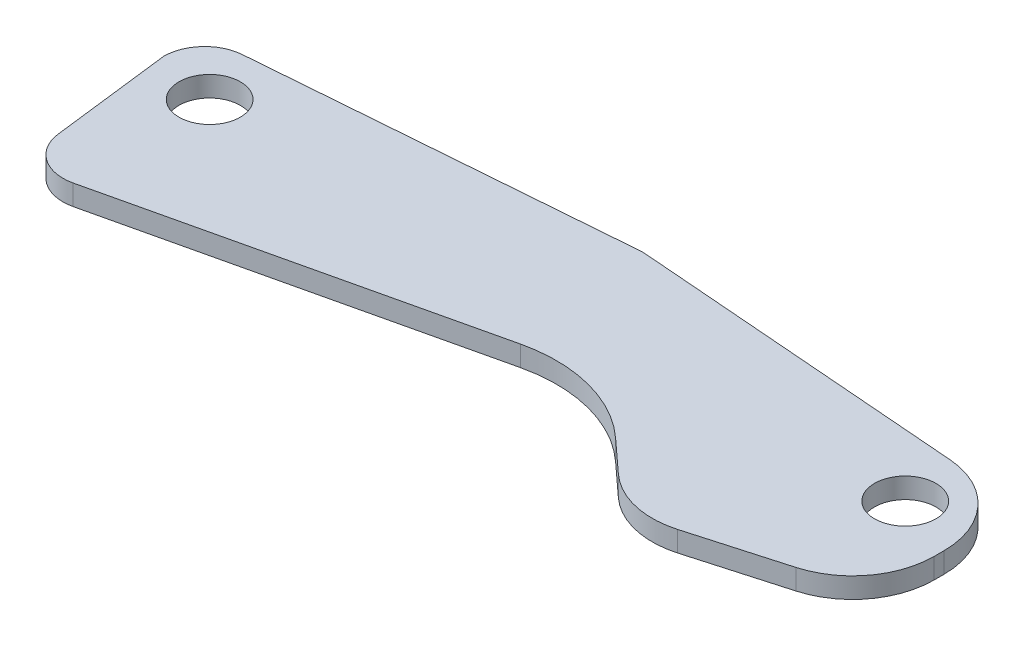
from build123d import *

# Parameters (mm, degrees)
SKETCH1_W           = 40
SKETCH1_H           = 11.5
BOSS_EXTRUDE1_DEPTH = 1
CUT_EXTRUDE1_DEPTH  = 1
FILLET1_R           = 2
FILLET2_R           = 4
FILLET3_R           = 2
CUT_EXTRUDE2_DEPTH  = 1
CUT_EXTRUDE3_DEPTH  = 1
FILLET4_R           = 2
FILLET5_R           = 7
FILLET6_R           = 4
FILLET7_R           = 4
SKETCH5_R           = 1.5
SKETCH5_R_2         = 1.501453264
CUT_EXTRUDE4_DEPTH  = 1


with BuildPart() as part:
    # Sketch1 → Boss-Extrude1 (new body)
    with BuildSketch(Plane(origin=(0, 0, 0), x_dir=(1, 0, 0), z_dir=(0, 1, 0))):
        Rectangle(SKETCH1_W, SKETCH1_H)
    extrude(amount=BOSS_EXTRUDE1_DEPTH)

    # Sketch2 → Cut-Extrude1 (cut)
    with BuildSketch(Plane(origin=(0, 1, 0), x_dir=(1, 0, 0), z_dir=(0, 1, 0))):
        Polygon((-20, 4.177870703), (0, 5.75), (-20, 5.75), align=None)
        Polygon((20, 5.75), (0, 5.75), (20, 4.177870703), align=None)
    extrude(amount=-CUT_EXTRUDE1_DEPTH, mode=Mode.SUBTRACT)

    # Fillet1
    fillet1_edges = [part.edges().sort_by_distance(p)[0] for p in [
        (0, 0.5, -5.75),
    ]]
    fillet(fillet1_edges, radius=FILLET1_R)

    # Fillet2
    fillet2_edges = [part.edges().sort_by_distance(p)[0] for p in [
        (20, 0.5, -4.177870703),
    ]]
    fillet(fillet2_edges, radius=FILLET2_R)

    # Fillet3
    fillet3_edges = [part.edges().sort_by_distance(p)[0] for p in [
        (-20, 0.5, -4.177870703),
    ]]
    fillet(fillet3_edges, radius=FILLET3_R)

    # Sketch3 → Cut-Extrude2 (cut)
    with BuildSketch(Plane(origin=(0, 1, 0), x_dir=(1, 0, 0), z_dir=(0, 1, 0))):
        Polygon((-20, 2.328914172), (-19.016050198, -5.75), (-20, -5.75), align=None)
    extrude(amount=-CUT_EXTRUDE2_DEPTH, mode=Mode.SUBTRACT)

    # Sketch4 → Cut-Extrude3 (cut)
    with BuildSketch(Plane(origin=(0, 1, 0), x_dir=(1, 0, 0), z_dir=(0, 1, 0))):
        Polygon((4.487841755, -0.29957878), (-19.016050198, -5.75), (10.444676757, -5.75), align=None)
        Polygon((20, -3.02478939), (10.444676757, -5.75), (20, -5.75), align=None)
    extrude(amount=-CUT_EXTRUDE3_DEPTH, mode=Mode.SUBTRACT)

    # Fillet4
    fillet4_edges = [part.edges().sort_by_distance(p)[0] for p in [
        (-19.016050198, 0.5, 5.75),
    ]]
    fillet(fillet4_edges, radius=FILLET4_R)

    # Fillet5
    fillet5_edges = [part.edges().sort_by_distance(p)[0] for p in [
        (4.487841755, 0.5, 0.29957878),
    ]]
    fillet(fillet5_edges, radius=FILLET5_R)

    # Fillet6
    fillet6_edges = [part.edges().sort_by_distance(p)[0] for p in [
        (10.444676757, 0.5, 5.75),
    ]]
    fillet(fillet6_edges, radius=FILLET6_R)

    # Fillet7
    fillet7_edges = [part.edges().sort_by_distance(p)[0] for p in [
        (20, 0.5, 3.02478939),
    ]]
    fillet(fillet7_edges, radius=FILLET7_R)

    # Sketch5 → Cut-Extrude4 (cut)
    with BuildSketch(Plane(origin=(0, 1, 0), x_dir=(1, 0, 0), z_dir=(0, 1, 0))):
        with Locations(Location((-17.048407867, 1.6240543, 0), (0, 0, 270))):
            Circle(SKETCH5_R)
        with Locations(Location((16.951592133, 1.6240543, 0), (0, 0, 270))):
            Circle(SKETCH5_R_2)
    extrude(amount=-CUT_EXTRUDE4_DEPTH, mode=Mode.SUBTRACT)


solid = part.part
